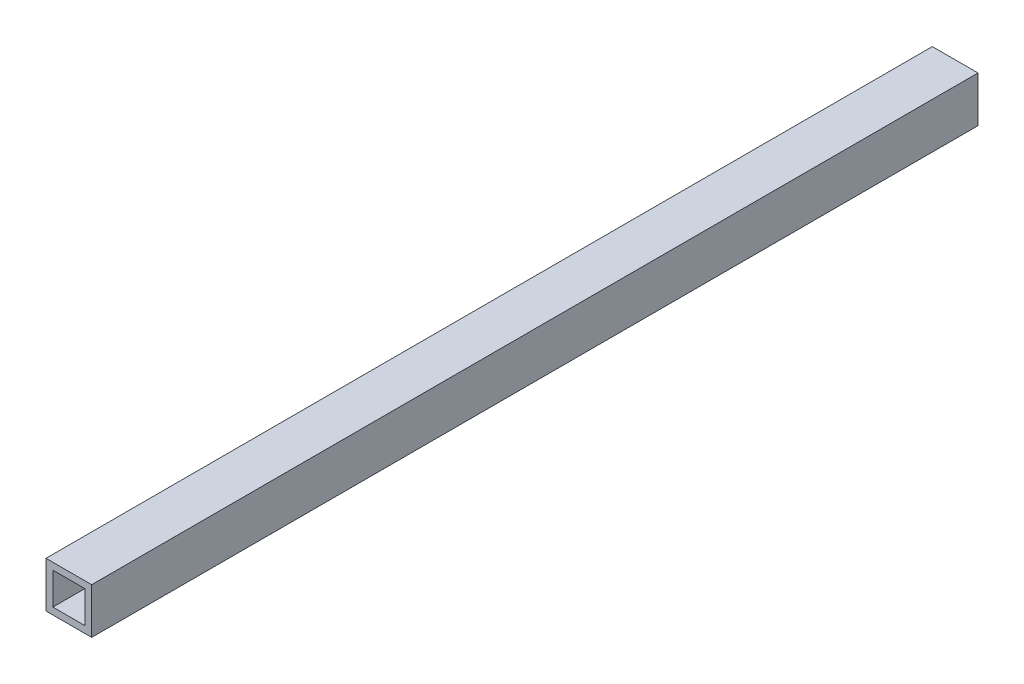
from build123d import *

# Parameters (mm, degrees)
SKETCH1_W           = 10
SKETCH1_H           = 10
SKETCH1_W_2         = 7
SKETCH1_H_2         = 7
BOSS_EXTRUDE1_DEPTH = 194


with BuildPart() as part:
    # Sketch1 → Boss-Extrude1 (new body)
    with BuildSketch(Plane.XY):
        Rectangle(SKETCH1_W, SKETCH1_H)
        Rectangle(SKETCH1_W_2, SKETCH1_H_2, mode=Mode.SUBTRACT)
    extrude(amount=BOSS_EXTRUDE1_DEPTH)


solid = part.part
